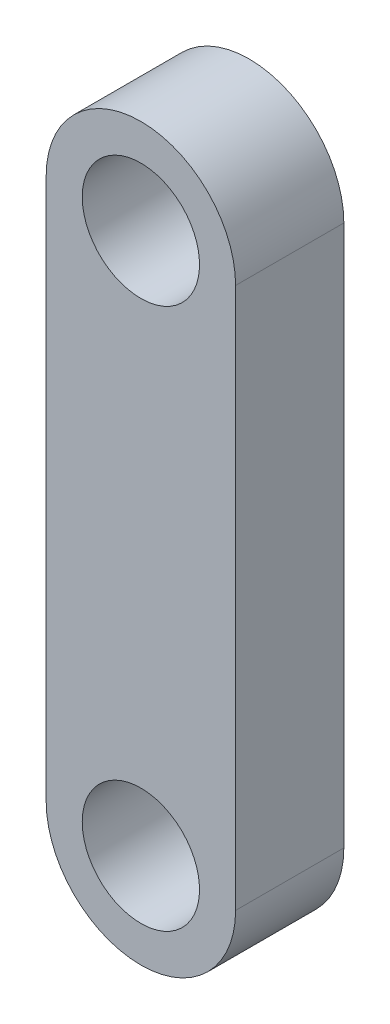
from build123d import *

# Parameters (mm, degrees)
BOSS_EXTRUDE1_DEPTH = 6
SKETCH1_3_R         = 3.25
CUT_EXTRUDE1_DEPTH  = 16


with BuildPart() as part:
    # Sketch1 → Boss-Extrude1 (new body)
    with BuildSketch(Plane.XY):
        with BuildLine():
            Line((-5.25, 0), (-5.25, -30))
            ThreePointArc((-5.25, -30), (0, -35.25), (5.25, -30))
            Line((5.25, -30), (5.25, 0))
            ThreePointArc((5.25, 0), (0, 5.25), (-5.25, 0))
        make_face()
    extrude(amount=BOSS_EXTRUDE1_DEPTH)

    # Sketch1<3> → Cut-Extrude1 (cut)
    with BuildSketch(Plane.XY):
        Circle(SKETCH1_3_R)
        with Locations((0, -30)):
            Circle(SKETCH1_3_R)
    extrude(amount=CUT_EXTRUDE1_DEPTH, mode=Mode.SUBTRACT)


solid = part.part
